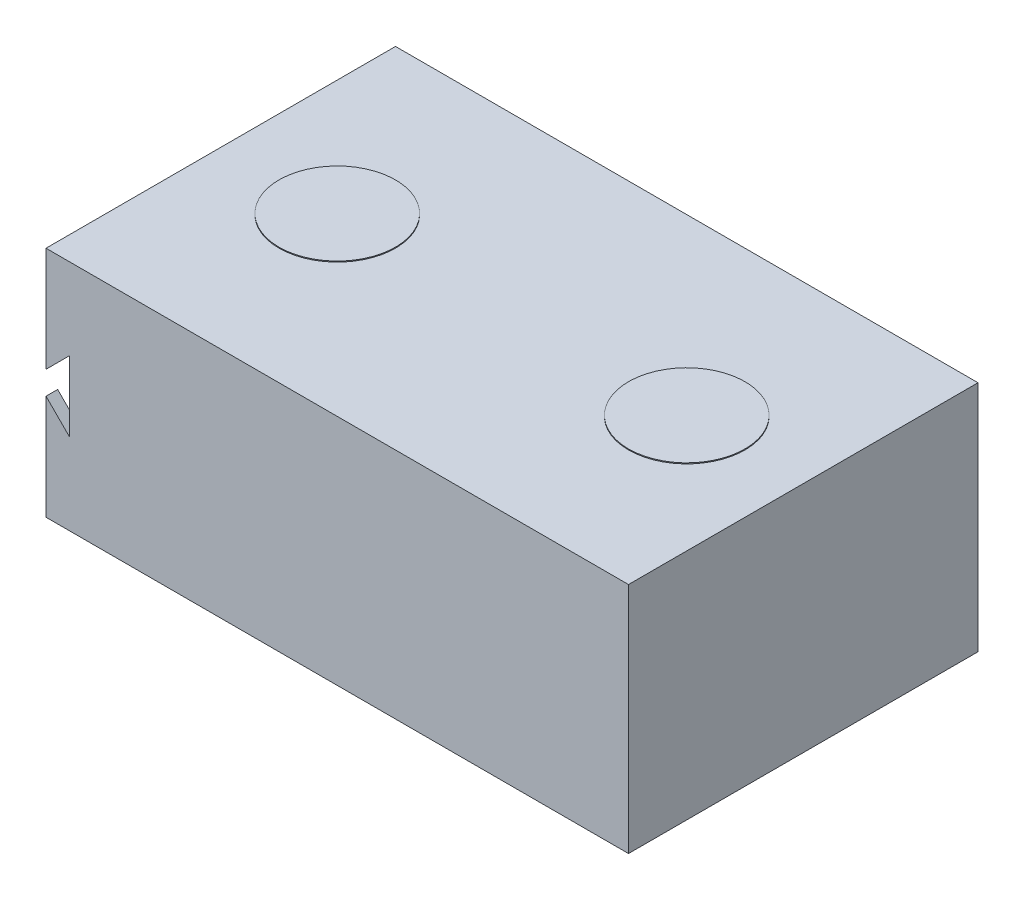
from build123d import *

# Parameters (mm, degrees)
SKETCH_1_W          = 250
SKETCH_1_H          = 150
EXTRUDE_1_DEPTH     = 100
SKETCH_2_R          = 25
EXTRUDE_2_DEPTH     = 0.4
SKETCH_5_W          = 245
SKETCH_5_H          = 140
CUT_EXTRUDE_1_DEPTH = 95
SKETCH_7_W          = 10
SKETCH_7_H          = 10
CUT_EXTRUDE_2_DEPTH = 5
CUT_EXTRUDE_3_DEPTH = 5
SKETCH_10_W         = 10
SKETCH_10_H         = 10
CUT_EXTRUDE_4_DEPTH = 5
CUT_EXTRUDE_6_DEPTH = 5


with BuildPart() as part:
    # 草图1 → 凸台-拉伸1 (new body)
    with BuildSketch(Plane(origin=(0, 0, 0), x_dir=(1, 0, 0), z_dir=(0, 1, 0))):
        with Locations((1.420454545, -10.84280303)):
            Rectangle(SKETCH_1_W, SKETCH_1_H)
    extrude(amount=EXTRUDE_1_DEPTH)

    # 草图2 → 凸台-拉伸2 (add)
    with BuildSketch(Plane(origin=(0, 100, 0), x_dir=(1, 0, 0), z_dir=(0, 1, 0))):
        with Locations(Location((76.420454545, -10.84280303, 0), (0, 0, 270))):
            Circle(SKETCH_2_R)
        with Locations(Location((-73.579545455, -10.84280303, 0), (0, 0, 270))):
            Circle(SKETCH_2_R)
    extrude(amount=EXTRUDE_2_DEPTH)

    # 草图5 → 切除-拉伸1 (cut)
    with BuildSketch(Plane.XZ):
        with Locations((-1.079545455, 10.84280303)):
            Rectangle(SKETCH_5_W, SKETCH_5_H)
    extrude(amount=-CUT_EXTRUDE_1_DEPTH, mode=Mode.SUBTRACT)

    # 草图7 → 切除-拉伸2 (cut)
    with BuildSketch(Plane.XY.offset(85.84280303)):
        with Locations((-118.579545455, 50)):
            Rectangle(SKETCH_7_W, SKETCH_7_H)
    extrude(amount=-CUT_EXTRUDE_2_DEPTH, mode=Mode.SUBTRACT)

    # 草图9 → 切除-拉伸3 (cut)
    with BuildSketch(Plane.XY.offset(85.84280303)):
        Polygon((-123.579545455, 55), (-113.579545455, 65), (-113.579545455, 55), align=None)
        Polygon((-123.579545455, 45), (-113.579545455, 45), (-113.579545455, 35), align=None)
    extrude(amount=-CUT_EXTRUDE_3_DEPTH, mode=Mode.SUBTRACT)

    # 草图10 → 切除-拉伸4 (cut)
    with BuildSketch(Plane(origin=(0, 0, -64.15719697), x_dir=(-1, 0, 0), z_dir=(0, 0, -1))):
        with Locations((118.579545455, 50)):
            Rectangle(SKETCH_10_W, SKETCH_10_H)
    extrude(amount=-CUT_EXTRUDE_4_DEPTH, mode=Mode.SUBTRACT)

    # 草图17 → 切除-拉伸6 (cut)
    with BuildSketch(Plane(origin=(0, 0, -64.15719697), x_dir=(-1, 0, 0), z_dir=(0, 0, -1))):
        Polygon((123.579545455, 55), (113.579545455, 65), (113.579545455, 55), align=None)
        Polygon((123.579545455, 45), (113.579545455, 35), (113.579545455, 45), align=None)
    extrude(amount=-CUT_EXTRUDE_6_DEPTH, mode=Mode.SUBTRACT)


solid = part.part
